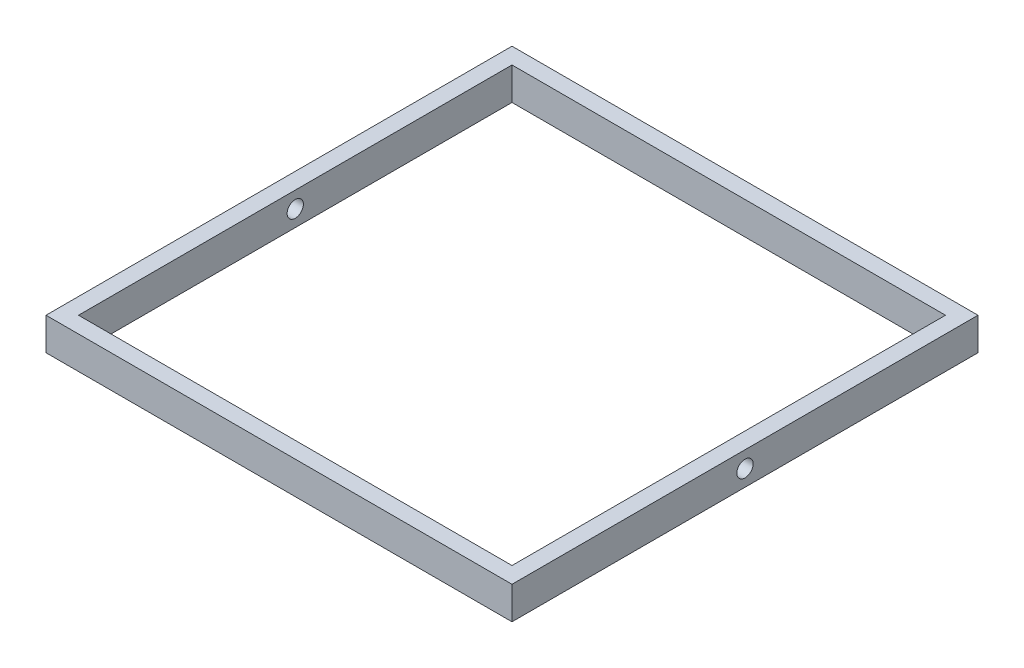
from build123d import *

# Parameters (mm, degrees)
SKETCH1_W               = 86
SKETCH1_H               = 86
SKETCH1_W_2             = 80
SKETCH1_H_2             = 80
EXTRUDE_THIN1_DEPTH     = 6
CUT_EXTRUDE1_DEPTH      = 94.669632219
CUT_EXTRUDE1_DEPTH_BACK = 94.669632219
SKETCH2_R               = 1.5


with BuildPart() as part:
    # Sketch1 → Extrude-Thin1 (new body)
    with BuildSketch(Plane(origin=(0, 0, 0), x_dir=(1, 0, 0), z_dir=(0, 1, 0))):
        with Locations((-0.220557938, 0)):
            Rectangle(SKETCH1_W, SKETCH1_H)
        with Locations((-0.220557938, 0)):
            Rectangle(SKETCH1_W_2, SKETCH1_H_2, mode=Mode.SUBTRACT)
    extrude(amount=EXTRUDE_THIN1_DEPTH)

    # Sketch2 → Cut-Extrude1 (cut, two sides: drawn at the far end of the back side and taken through both)
    with BuildSketch(Plane.ZY.offset(-39.779442062).offset(-CUT_EXTRUDE1_DEPTH_BACK)):
        with Locations((0, 3)):
            Circle(SKETCH2_R)
    extrude(amount=CUT_EXTRUDE1_DEPTH + CUT_EXTRUDE1_DEPTH_BACK, mode=Mode.SUBTRACT)


solid = part.part
